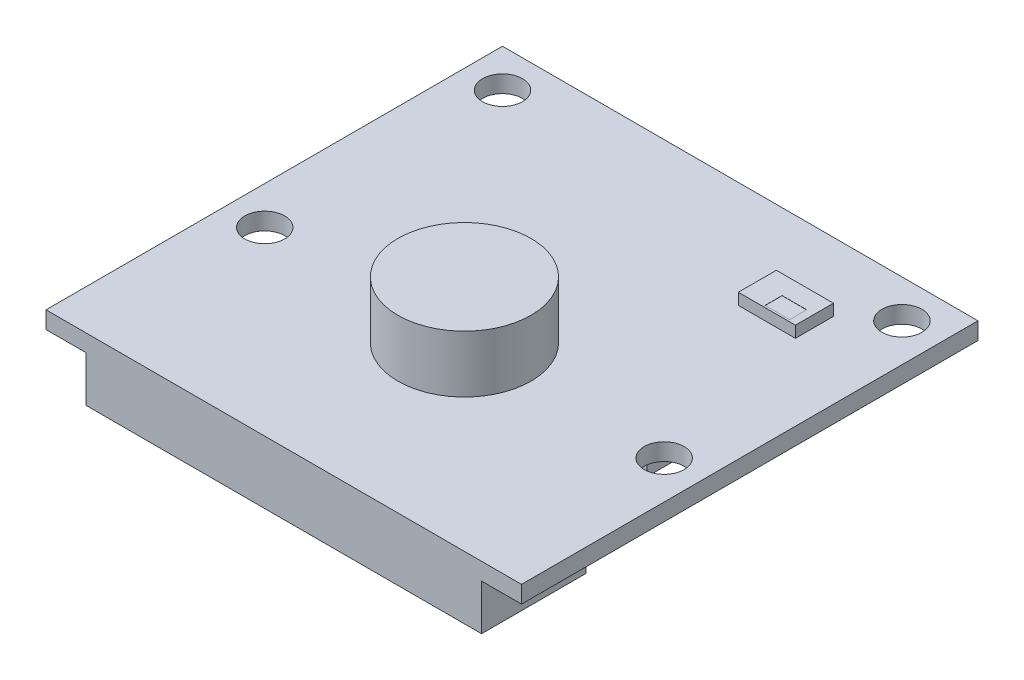
from build123d import *

# Parameters (mm, degrees)
SKIZZE1_W                                 = 25
SKIZZE1_H                                 = 24
PCB_DEPTH                                 = 0.9
SKIZZE2_R                                 = 1.05
MOUNTING_HOLES_DEPTH                      = 20.165333287
SKIZZE3_W                                 = 20.8
SKIZZE3_H                                 = 5.5
CONNECTOR_CLOSED_DEPTH                    = 2.4
SKIZZE4_W                                 = 17.7
SKIZZE4_H                                 = 11.6
COMPONENTS_WORST_CASE_BOUNDARY_BOX_DEPTH  = 1.3
SKIZZE7_W                                 = 3
SKIZZE7_H                                 = 2
COMPONENTS_WORST_CASE_BOUNDARY_BOX2_DEPTH = 0.6
SKIZZE8_W                                 = 1.3
SKIZZE8_H                                 = 0.9
STATUS_LED_DEPTH                          = 0.01
ESBO_O1_R                                 = 3.5
RESSALTO_EXTRUS_O2_DEPTH                  = 3


with BuildPart() as part:
    # Skizze1 → PCB (new body)
    with BuildSketch(Plane(origin=(0, 0, 0), x_dir=(1, 0, 0), z_dir=(0, 1, 0))):
        with Locations((0, 2.5)):
            Rectangle(SKIZZE1_W, SKIZZE1_H)
    extrude(amount=-PCB_DEPTH)

    # Skizze2 → Mounting_Holes (cut, through all)
    with BuildSketch(Plane(origin=(0, 0, 0), x_dir=(1, 0, 0), z_dir=(0, 1, 0))):
        with Locations(Location((10.5, 12.5, 0), (0, 0, 270))):
            Circle(SKIZZE2_R)
        with Locations(Location((10.5, 0, 0), (0, 0, 270))):
            Circle(SKIZZE2_R)
        with Locations(Location((-10.5, 0, 0), (0, 0, 90))):
            Circle(SKIZZE2_R)
        with Locations(Location((-10.5, 12.5, 0), (0, 0, 90))):
            Circle(SKIZZE2_R)
    extrude(amount=-MOUNTING_HOLES_DEPTH, mode=Mode.SUBTRACT)

    # Skizze3 → Connector_closed (add)
    with BuildSketch(Plane.XZ.offset(0.9)):
        with Locations((0, 6.75)):
            Rectangle(SKIZZE3_W, SKIZZE3_H)
    extrude(amount=CONNECTOR_CLOSED_DEPTH)

    # Skizze4 → Components_worst-case_Boundary-Box (add)
    with BuildSketch(Plane.XZ.offset(0.9)):
        with Locations((-0.15, -6.7)):
            Rectangle(SKIZZE4_W, SKIZZE4_H)
    extrude(amount=COMPONENTS_WORST_CASE_BOUNDARY_BOX_DEPTH)

    # Skizze7 → Components_worst-case_Boundary-Box2 (add)
    with BuildSketch(Plane(origin=(0, 0, 0), x_dir=(1, 0, 0), z_dir=(0, 1, 0))):
        with Locations((7, 9.9)):
            Rectangle(SKIZZE7_W, SKIZZE7_H)
    extrude(amount=COMPONENTS_WORST_CASE_BOUNDARY_BOX2_DEPTH)

    # Skizze8 → Status_LED (cut)
    with BuildSketch(Plane(origin=(0, 0.6, 0), x_dir=(1, 0, 0), z_dir=(0, 1, 0))):
        with Locations((7.45, 9.45)):
            Rectangle(SKIZZE8_W, SKIZZE8_H)
    extrude(amount=-STATUS_LED_DEPTH, mode=Mode.SUBTRACT)

    # Esboço1 → Ressalto-extrusão2 (add)
    with BuildSketch(Plane(origin=(0, 0, 0), x_dir=(1, 0, 0), z_dir=(0, 1, 0))):
        with Locations(Location((0, 0, 0), (0, 0, 270))):
            Circle(ESBO_O1_R)
    extrude(amount=RESSALTO_EXTRUS_O2_DEPTH)


solid = part.part
